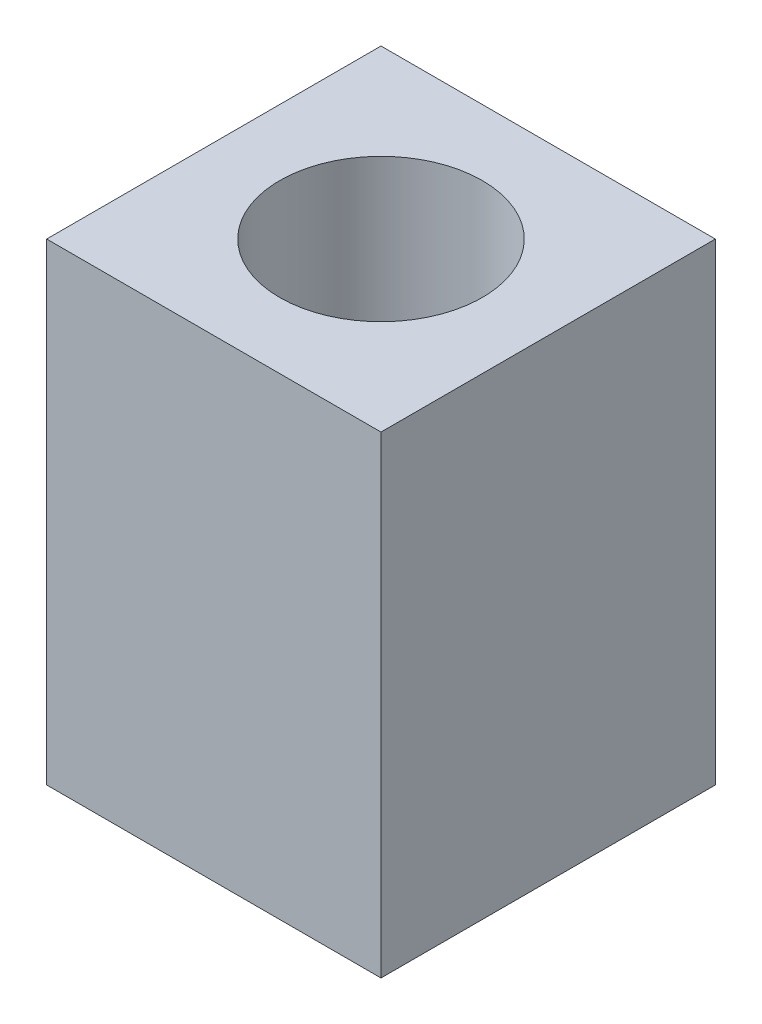
from build123d import *

# Parameters (mm, degrees)
SKETCH1_W           = 4.949747468
SKETCH1_H           = 4.949747468
SKETCH1_R           = 1.5
BOSS_EXTRUDE1_DEPTH = 7


with BuildPart() as part:
    # Sketch1 → Boss-Extrude1 (new body)
    with BuildSketch(Plane(origin=(0, 0, 0), x_dir=(1, 0, 0), z_dir=(0, 1, 0))):
        with Locations((-2.474873734, 2.474873734)):
            Rectangle(SKETCH1_W, SKETCH1_H)
        with Locations(Location((-2.474873734, 2.474873734, 0), (0, 0, 270))):
            Circle(SKETCH1_R, mode=Mode.SUBTRACT)
    extrude(amount=BOSS_EXTRUDE1_DEPTH)


solid = part.part
